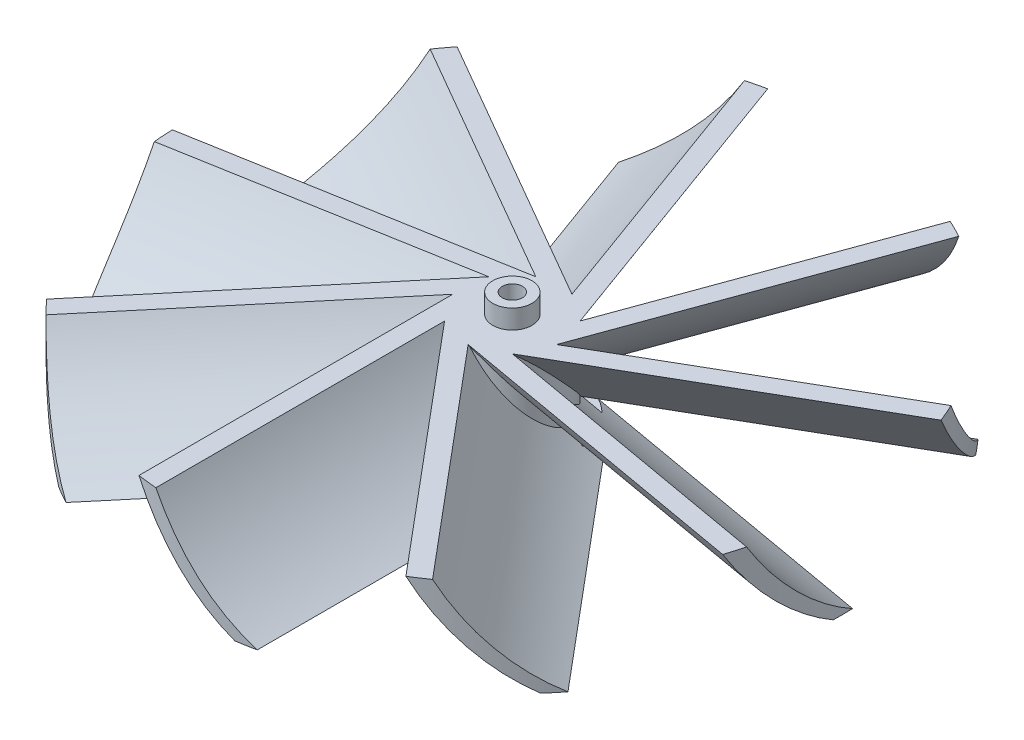
from build123d import *

# Parameters (mm, degrees)
BOSS_EXTRUDE1_DEPTH      = 5
BOSS_EXTRUDE1_DEPTH_BACK = 5
SKETCH1_R                = 5
BOSS_EXTRUDE2_DEPTH      = 45
CIRPATTERN1_COUNT        = 9
SKETCH4_R                = 134.5
SKETCH4_R_2              = 34.5
CUT_EXTRUDE1_DEPTH       = 45
CUT_EXTRUDE2_DEPTH       = 5
SKETCH6_R                = 6.634774001
SKETCH6_R_2              = 5
BOSS_EXTRUDE3_DEPTH      = 1
SKETCH7_R                = 2.05
SKETCH7_R_2              = 1.05
BOSS_EXTRUDE4_DEPTH      = 2
CUT_EXTRUDE3_START       = -2
SKETCH8_R                = 1.05
CUT_EXTRUDE3_DEPTH       = 2


with BuildPart() as part:
    # Sketch1 → Boss-Extrude1 (new, two sides: drawn at the far end of the back side and taken through both)
    with BuildSketch(Plane(origin=(0, 0, 0), x_dir=(1, 0, 0), z_dir=(0, 1, 0)).offset(-BOSS_EXTRUDE1_DEPTH_BACK)):
        with Locations(Location((0, 0, 0), (0, 0, 270))):
            Circle(SKETCH1_R)
    extrude(amount=BOSS_EXTRUDE1_DEPTH + BOSS_EXTRUDE1_DEPTH_BACK)

    # Sketch2 → Boss-Extrude2 (add)
    with BuildSketch(Plane.XY):
        with BuildLine():
            Line((-4.917468245, 5), (-2.917468245, 5))
            ThreePointArc((-2.917468245, 5), (1.424269267, -0.658262488), (7.082531755, -5))
            Line((7.082531755, -5), (5.082531755, -5))
            ThreePointArc((5.082531755, -5), (-0.575730733, -0.658262488), (-4.917468245, 5))
        make_face()
    boss_extrude2 = extrude(amount=BOSS_EXTRUDE2_DEPTH)

    # CirPattern1: Boss-Extrude2 ×9 about axis
    cirpattern1_axis = Axis((0, 0, 0), (0, 1, 0))
    for i in range(1, CIRPATTERN1_COUNT):
        add(boss_extrude2.rotate(cirpattern1_axis, i * 360 / CIRPATTERN1_COUNT))

    # Sketch4 → Cut-Extrude1 (cut)
    with BuildSketch(Plane(origin=(0, 5, 0), x_dir=(1, 0, 0), z_dir=(0, 1, 0))):
        Circle(SKETCH4_R)
        Circle(SKETCH4_R_2, mode=Mode.SUBTRACT)
    extrude(amount=-CUT_EXTRUDE1_DEPTH, mode=Mode.SUBTRACT)

    # Sketch5 → Cut-Extrude2 (cut)
    with BuildSketch(Plane.XZ.offset(5)):
        with BuildLine():
            Line((-0.6875, -1.094486181), (-0.6875, 1.094486181))
            ThreePointArc((-0.6875, 1.094486181), (1.2925, 0), (-0.6875, -1.094486181))
        make_face()
    extrude(amount=-CUT_EXTRUDE2_DEPTH, mode=Mode.SUBTRACT)

    # Sketch6 → Boss-Extrude3 (add)
    with BuildSketch(Plane.XZ.offset(5)):
        Circle(SKETCH6_R)
        Circle(SKETCH6_R_2, mode=Mode.SUBTRACT)
    extrude(amount=-BOSS_EXTRUDE3_DEPTH)

    # Sketch7 → Boss-Extrude4 (add)
    with BuildSketch(Plane(origin=(0, 5, 0), x_dir=(1, 0, 0), z_dir=(0, 1, 0))):
        with Locations(Location((0, 0, 0), (0, 0, 270))):
            Circle(SKETCH7_R)
        with Locations(Location((0, 0, 0), (0, 0, 270))):
            Circle(SKETCH7_R_2, mode=Mode.SUBTRACT)
    extrude(amount=BOSS_EXTRUDE4_DEPTH)

    # Sketch8 → Cut-Extrude3 (cut)
    with BuildSketch(Plane(origin=(0, 5, 0), x_dir=(1, 0, 0), z_dir=(0, 1, 0)).offset(CUT_EXTRUDE3_START)):
        with Locations(Location((0, 0, 0), (0, 0, 270))):
            Circle(SKETCH8_R)
    extrude(amount=CUT_EXTRUDE3_DEPTH, mode=Mode.SUBTRACT)


solid = part.part
